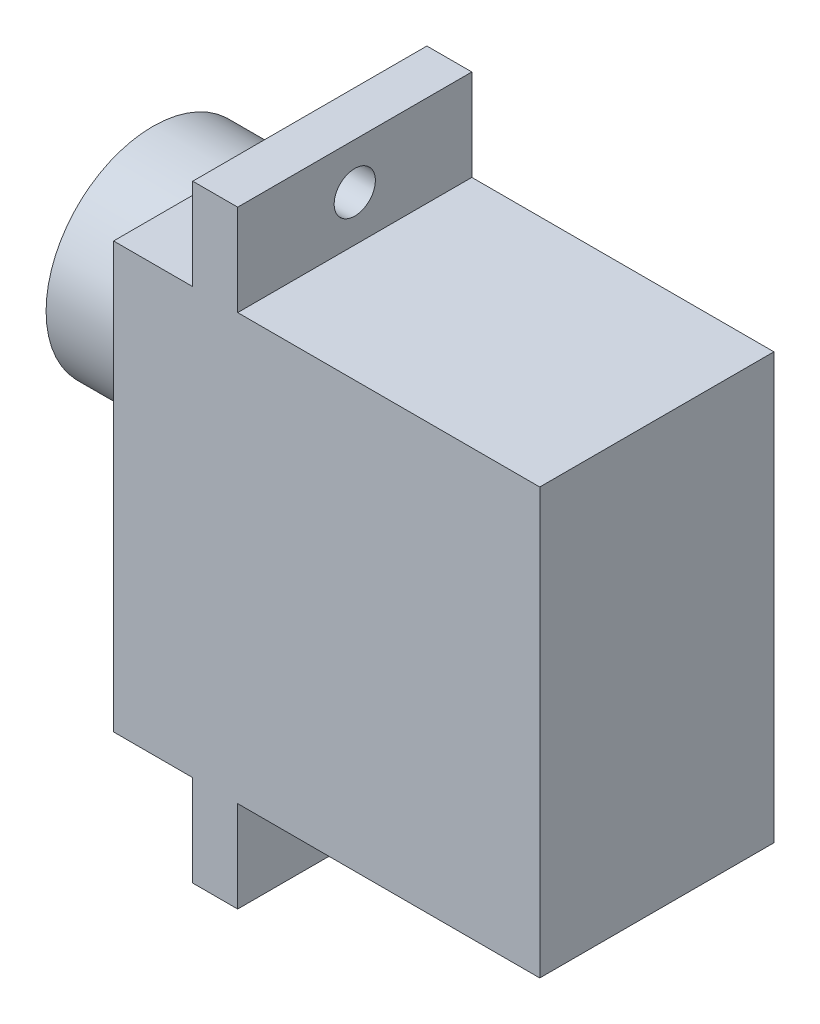
from build123d import *

# Parameters (mm, degrees)
SKETCH1_W           = 22.75
SKETCH1_H           = 22.7
BOSS_EXTRUDE1_DEPTH = 12.5
SKETCH2_R           = 5.7
BOSS_EXTRUDE2_DEPTH = 4.25
SKETCH3_R           = 2.3
CUT_EXTRUDE1_DEPTH  = 2
SKETCH4_W           = 12.5
SKETCH4_H           = 4.875
BOSS_EXTRUDE3_DEPTH = 2.4
SKETCH5_R           = 1.1
CUT_EXTRUDE2_DEPTH  = 2.4


with BuildPart() as part:
    # Sketch1 → Boss-Extrude1 (new body)
    with BuildSketch(Plane.XY):
        Rectangle(SKETCH1_W, SKETCH1_H)
    extrude(amount=BOSS_EXTRUDE1_DEPTH)

    # Sketch2 → Boss-Extrude2 (add)
    with BuildSketch(Plane.ZY.offset(11.375)):
        with Locations(Location((6.152972547, 5.65, 0), (0, 0, 90))):
            Circle(SKETCH2_R)
    extrude(amount=BOSS_EXTRUDE2_DEPTH)

    # Sketch3 → Cut-Extrude1 (cut)
    with BuildSketch(Plane.ZY.offset(15.625)):
        with Locations((6.152972547, 5.65)):
            Circle(SKETCH3_R)
    extrude(amount=-CUT_EXTRUDE1_DEPTH, mode=Mode.SUBTRACT)

    # Sketch4 → Boss-Extrude3 (add)
    with BuildSketch(Plane(origin=(-7.15, 0, 0), x_dir=(0, 0, -1), z_dir=(1, 0, 0))):
        with Locations((-6.25, 13.7875)):
            Rectangle(SKETCH4_W, SKETCH4_H)
        with Locations((-6.25, -13.7875)):
            Rectangle(SKETCH4_W, SKETCH4_H)
    extrude(amount=BOSS_EXTRUDE3_DEPTH)

    # Sketch5 → Cut-Extrude2 (cut)
    with BuildSketch(Plane.ZY.offset(7.15)):
        with Locations((6.25, 13.7875)):
            Circle(SKETCH5_R)
        with Locations(Location((6.25, -13.7875, 0), (0, 0, 180))):
            Circle(SKETCH5_R)
    extrude(amount=-CUT_EXTRUDE2_DEPTH, mode=Mode.SUBTRACT)


solid = part.part
